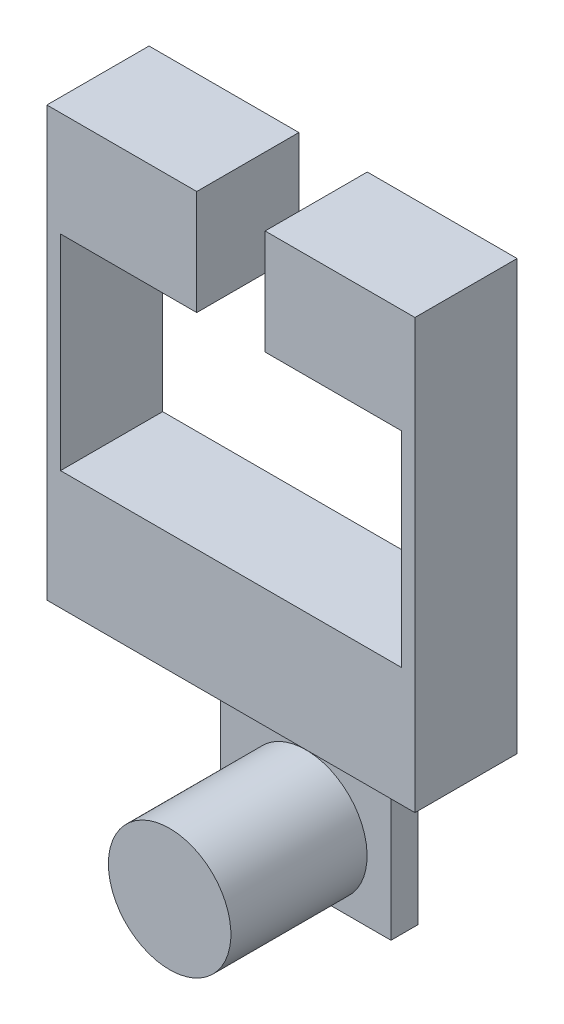
from build123d import *

# Parameters (mm, degrees)
SKETCH1_W            = 68.64096
SKETCH1_H            = 79.975020836
MAIN_BODY_DEPTH      = 9.525
SKETCH2_W            = 63.56096
SKETCH2_H            = 38.227
LOWER_T_CAVITY_DEPTH = 90.088729956
SKETCH3_W            = 12.7508
SKETCH3_H            = 19.558
TOP_SLOT_DEPTH       = 90.088729956
SKETCH4_W            = 31.75
SKETCH4_H            = 36.82365
HANGER_DEPTH         = 5.08
SKETCH5_R            = 11.42365
STRAP_PIN_DEPTH      = 30.48


with BuildPart() as part:
    # Sketch1 → Main-Body (new, symmetric)
    with BuildSketch(Plane.XY):
        with Locations((0, 39.987510418)):
            Rectangle(SKETCH1_W, SKETCH1_H)
    extrude(amount=MAIN_BODY_DEPTH, both=True)

    # Sketch2 → Lower-T-Cavity (cut, through all)
    with BuildSketch(Plane.XY.offset(9.525)):
        with Locations((0, 41.303520836)):
            Rectangle(SKETCH2_W, SKETCH2_H)
    extrude(amount=-LOWER_T_CAVITY_DEPTH, mode=Mode.SUBTRACT)

    # Sketch3 → Top-Slot (cut, through all)
    with BuildSketch(Plane.XY.offset(9.525)):
        with Locations((0, 70.196020836)):
            Rectangle(SKETCH3_W, SKETCH3_H)
    extrude(amount=-TOP_SLOT_DEPTH, mode=Mode.SUBTRACT)

    # Sketch4 → Hanger (add)
    with BuildSketch(Plane(origin=(0, 0, -9.525), x_dir=(-1, 0, 0), z_dir=(0, 0, -1))):
        with Locations((0, -18.411825)):
            Rectangle(SKETCH4_W, SKETCH4_H)
    extrude(amount=-HANGER_DEPTH)

    # Sketch5 → Strap-Pin (add)
    with BuildSketch(Plane(origin=(0, 0, -9.525), x_dir=(-1, 0, 0), z_dir=(0, 0, -1))):
        with Locations((0, -25.4)):
            Circle(SKETCH5_R)
    extrude(amount=-STRAP_PIN_DEPTH)


solid = part.part
